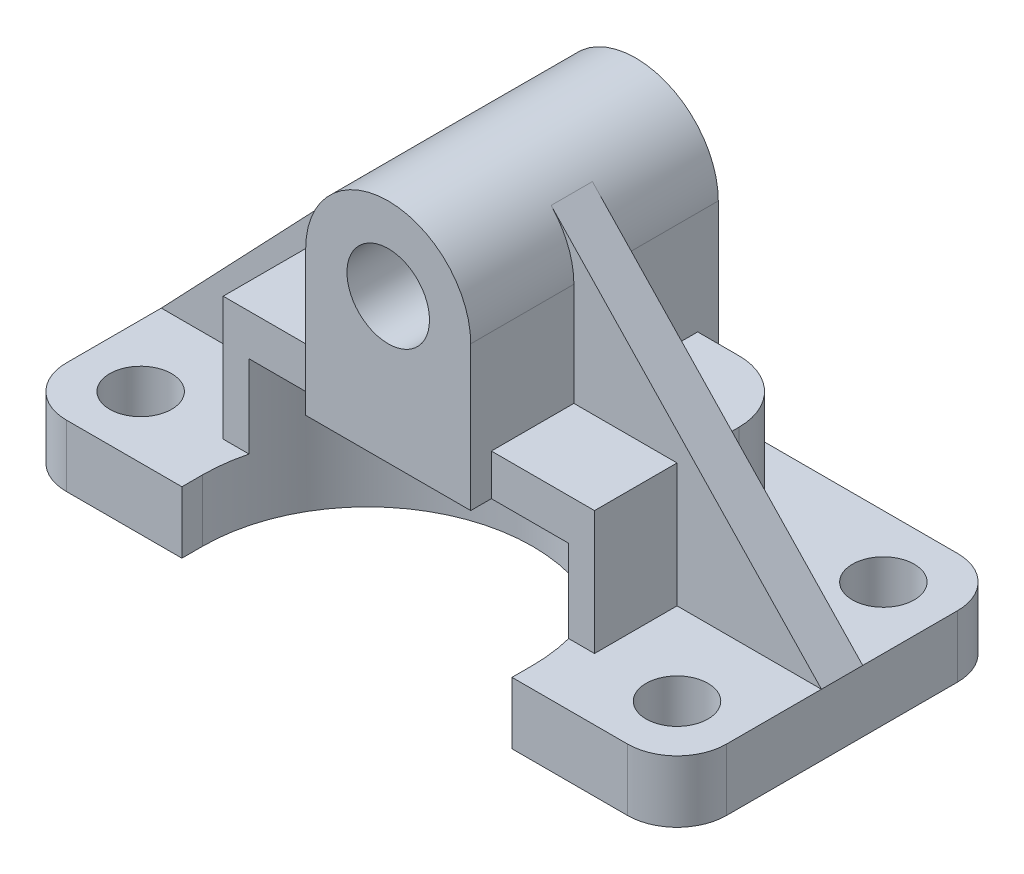
from build123d import *

# Parameters (mm, degrees)
SKETCH_1_W               = 160
SKETCH_1_H               = 80
EXTRUDE_1_DEPTH          = 15
SKETCH_2_W               = 90
SKETCH_2_H               = 50
EXTRUDE_2_DEPTH          = 45
EXTRUDE_8_DEPTH          = 30
RIB_9_REACH              = 128.886
SKETCH_7_WALL_W          = 350.771540414
SKETCH_7_WALL_H          = 10
CUT_EXTRUDE_1_DEPTH      = 35
SKETCH_10_R              = 7.5
CUT_EXTRUDE_2_DEPTH      = 127.885775405
MIRROR_3_COPY_1_SKETCH_R = 7.5
MIRROR_3_COPY_1_DEPTH    = 127.885775405
FILLET_1_R               = 12
FILLET_2_R               = 12
FILLET_3_R               = 12
FILLET_4_R               = 12
FILLET_5_R               = 15
FILLET_6_R               = 15
CUT_EXTRUDE_3_DEPTH      = 127.885775405
CUT_EXTRUDE_3_DEPTH_BACK = 127.885775405
SKETCH_11_R              = 10


with BuildPart() as part:
    # 草图1 → 凸台-拉伸1 (new body)
    with BuildSketch(Plane(origin=(0, 0, 0), x_dir=(1, 0, 0), z_dir=(0, 1, 0))):
        Rectangle(SKETCH_1_W, SKETCH_1_H)
    extrude(amount=EXTRUDE_1_DEPTH)

    # 草图2 → 凸台-拉伸2 (add)
    with BuildSketch(Plane(origin=(0, 0, 0), x_dir=(1, 0, 0), z_dir=(0, 1, 0))):
        Rectangle(SKETCH_2_W, SKETCH_2_H)
    extrude(amount=EXTRUDE_2_DEPTH)

    # 草图6 → 凸台-拉伸8 (add, symmetric)
    with BuildSketch(Plane.XY):
        with BuildLine():
            Line((0, 15), (20, 15))
            Line((20, 15), (20, 70))
            ThreePointArc((20, 70), (0, 90), (-20, 70))
            Line((-20, 70), (-20, 15))
            Line((-20, 15), (0, 15))
        make_face()
    extrude(amount=EXTRUDE_8_DEPTH, both=True)

    # 草图7 wall → 筋9 (add, up to next)
    with BuildSketch(Plane(origin=(-47.241382895, 49.396547961, 0), x_dir=(0.689655172411, 0.724137931037, 0), z_dir=(-0.724137931037, 0.689655172411, 0)), mode=Mode.PRIVATE) as rib_9_sk1:
        Rectangle(SKETCH_7_WALL_W, SKETCH_7_WALL_H)
    rib_9_tool1 = extrude(rib_9_sk1.sketch, amount=-RIB_9_REACH, mode=Mode.PRIVATE) - part.part
    rib_9 = rib_9_tool1.solids().sort_by_distance((-47.241382895, 49.396547961, 0))[0]
    add(rib_9)

    # 镜向1: 筋9 across plane
    add(rib_9.mirror(Plane(origin=(0, 0, 0), x_dir=(0, 0, 1), z_dir=(1, 0, 0))))

    # 草图8 → 切除-拉伸1 (cut)
    with BuildSketch(Plane(origin=(0, 0, 0), x_dir=(1, 0, 0), z_dir=(0, 1, 0))):
        with BuildLine():
            Line((-40, -40), (40, -40))
            Line((40, -40), (40, -35))
            ThreePointArc((40, -35), (0, 5), (-40, -35))
            Line((-40, -35), (-40, -40))
        make_face()
    extrude(amount=CUT_EXTRUDE_1_DEPTH, mode=Mode.SUBTRACT)

    # 草图10 → 切除-拉伸2 (cut, through all)
    with BuildSketch(Plane(origin=(0, 0, 0), x_dir=(1, 0, 0), z_dir=(0, 1, 0))):
        with Locations(Location((-65, 25, 0), (0, 0, 90))):
            Circle(SKETCH_10_R)
    cut_extrude_2 = extrude(amount=CUT_EXTRUDE_2_DEPTH, mode=Mode.SUBTRACT)

    # 镜向2: 切除-拉伸2 across plane
    add(cut_extrude_2.mirror(Plane(origin=(0, 0, 0), x_dir=(0, 0, 1), z_dir=(1, 0, 0))), mode=Mode.SUBTRACT)

    # 镜向3: 切除-拉伸2 across plane
    add(cut_extrude_2.mirror(Plane.XY), mode=Mode.SUBTRACT)

    # 镜向3 copy 1 sketch → 镜向3 copy 1 (cut, through all)
    with BuildSketch(Plane(origin=(0, 0, 0), x_dir=(-1, 0, 0), z_dir=(0, 1, 0))):
        with Locations(Location((-65, 25, 0), (0, 0, 90))):
            Circle(MIRROR_3_COPY_1_SKETCH_R)
    extrude(amount=MIRROR_3_COPY_1_DEPTH, mode=Mode.SUBTRACT)

    # 圆角1
    fillet_1_edges = [part.edges().sort_by_distance(p)[0] for p in [
        (-80, 7.5, -40),
    ]]
    fillet(fillet_1_edges, radius=FILLET_1_R)

    # 圆角2
    fillet_2_edges = [part.edges().sort_by_distance(p)[0] for p in [
        (80, 7.5, -40),
    ]]
    fillet(fillet_2_edges, radius=FILLET_2_R)

    # 圆角3
    fillet_3_edges = [part.edges().sort_by_distance(p)[0] for p in [
        (-80, 7.5, 40),
    ]]
    fillet(fillet_3_edges, radius=FILLET_3_R)

    # 圆角4
    fillet_4_edges = [part.edges().sort_by_distance(p)[0] for p in [
        (80, 7.5, 40),
    ]]
    fillet(fillet_4_edges, radius=FILLET_4_R)

    # 圆角5
    fillet_5_edges = [part.edges().sort_by_distance(p)[0] for p in [
        (-45, 30, -25),
    ]]
    fillet(fillet_5_edges, radius=FILLET_5_R)

    # 圆角6
    fillet_6_edges = [part.edges().sort_by_distance(p)[0] for p in [
        (45, 30, -25),
    ]]
    fillet(fillet_6_edges, radius=FILLET_6_R)

    # 草图11 → 切除-拉伸3 (cut, two sides: drawn at the far end of the back side and taken through both)
    with BuildSketch(Plane.XY.offset(-CUT_EXTRUDE_3_DEPTH_BACK)):
        with Locations((0, 70)):
            Circle(SKETCH_11_R)
    extrude(amount=CUT_EXTRUDE_3_DEPTH + CUT_EXTRUDE_3_DEPTH_BACK, mode=Mode.SUBTRACT)


solid = part.part
